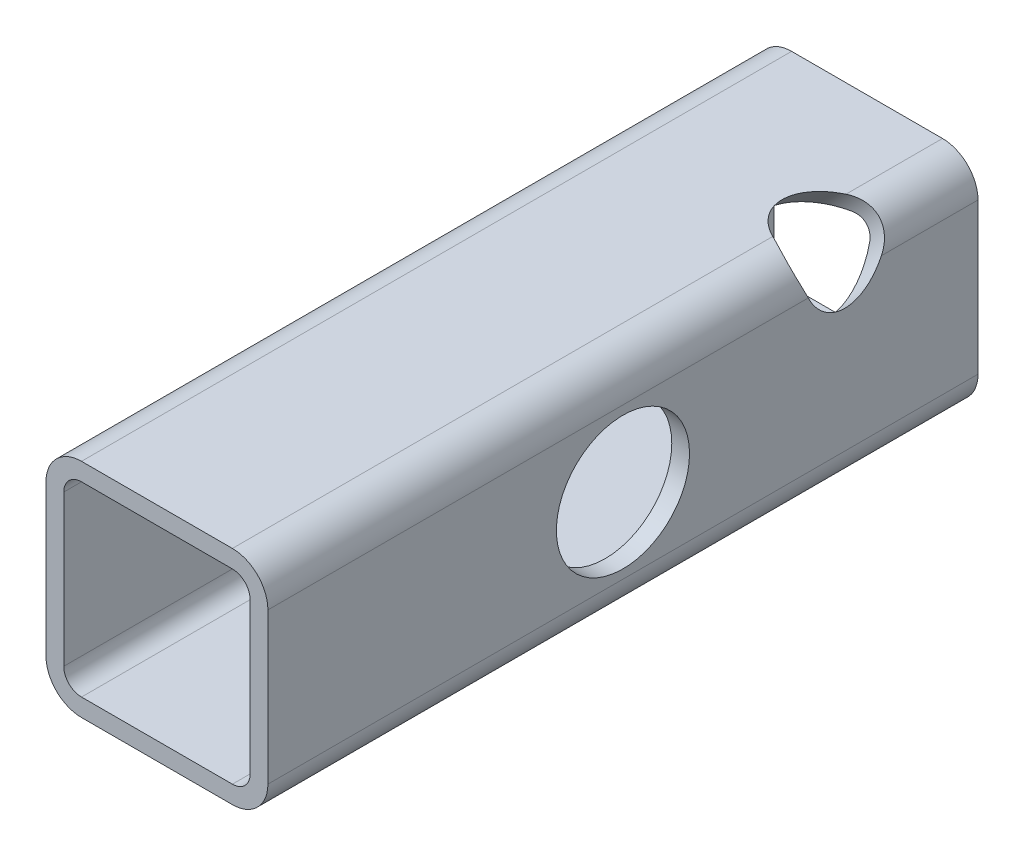
from build123d import *

# Parameters (mm, degrees)
EXTRUDE_1_DEPTH     = 80
SKETCH_2_R          = 7.5
CUT_EXTRUDE_1_DEPTH = 3
SKETCH_3_R          = 4.25
CUT_EXTRUDE_2_DEPTH = 3
SKETCH_4_R          = 5
CUT_EXTRUDE_3_DEPTH = 20


with BuildPart() as part:
    # Эскиз1 → Бобышка-Вытянуть1 (new body)
    with BuildSketch(Plane.XY):
        with BuildLine():
            Line((8.5, -12.5), (-8.5, -12.5))
            ThreePointArc((-8.5, -12.5), (-11.328427125, -11.328427125), (-12.5, -8.5))
            Line((-12.5, -8.5), (-12.5, 8.5))
            ThreePointArc((-12.5, 8.5), (-11.328427125, 11.328427125), (-8.5, 12.5))
            Line((-8.5, 12.5), (8.5, 12.5))
            ThreePointArc((8.5, 12.5), (11.328427125, 11.328427125), (12.5, 8.5))
            Line((12.5, 8.5), (12.5, -8.5))
            ThreePointArc((12.5, -8.5), (11.328427125, -11.328427125), (8.5, -12.5))
        make_face()
        with BuildLine():
            Line((-10.5, -8.5), (-10.5, 8.5))
            ThreePointArc((-10.5, 8.5), (-9.914213562, 9.914213562), (-8.5, 10.5))
            Line((-8.5, 10.5), (8.5, 10.5))
            ThreePointArc((8.5, 10.5), (9.914213562, 9.914213562), (10.5, 8.5))
            Line((10.5, 8.5), (10.5, -8.5))
            ThreePointArc((10.5, -8.5), (9.914213562, -9.914213562), (8.5, -10.5))
            Line((8.5, -10.5), (-8.5, -10.5))
            ThreePointArc((-8.5, -10.5), (-9.914213562, -9.914213562), (-10.5, -8.5))
        make_face(mode=Mode.SUBTRACT)
    extrude(amount=EXTRUDE_1_DEPTH)

    # Эскиз2 → Вырез-Вытянуть1 (cut)
    with BuildSketch(Plane(origin=(12.5, 0, 0), x_dir=(0, 0, -1), z_dir=(1, 0, 0))):
        with Locations((-40, 0)):
            Circle(SKETCH_2_R)
    extrude(amount=-CUT_EXTRUDE_1_DEPTH, mode=Mode.SUBTRACT)

    # Эскиз3 → Вырез-Вытянуть2 (cut)
    with BuildSketch(Plane.ZY.offset(12.5)):
        with Locations((40, 0)):
            Circle(SKETCH_3_R)
    extrude(amount=-CUT_EXTRUDE_2_DEPTH, mode=Mode.SUBTRACT)

    # Эскиз4 → Вырез-Вытянуть3 (cut)
    with BuildSketch(Plane(origin=(0, 0, 0), x_dir=(0, 0, -1), z_dir=(0.7071067811865488, 0.7071067811865464, 0))):
        with Locations((-15, 0)):
            Circle(SKETCH_4_R)
    extrude(amount=CUT_EXTRUDE_3_DEPTH, mode=Mode.SUBTRACT)


solid = part.part
